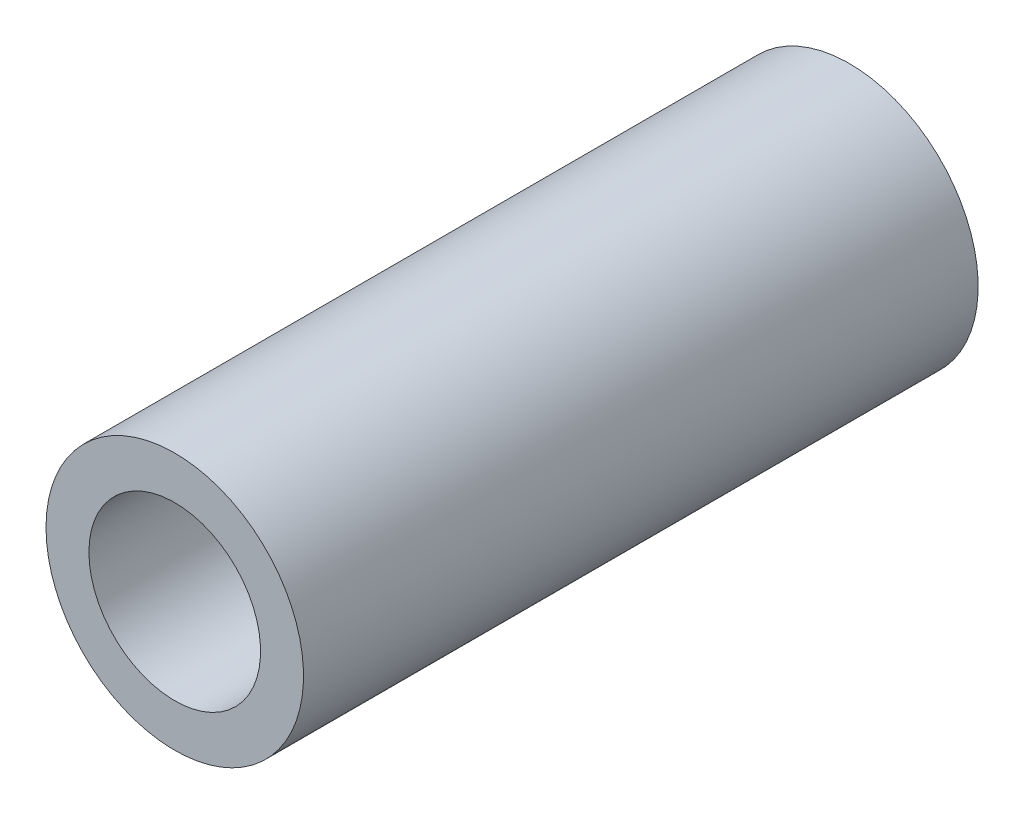
from build123d import *

# Parameters (mm, degrees)
SKETCH1_R           = 2.38125
SKETCH1_R_2         = 1.5875
BOSS_EXTRUDE1_DEPTH = 12.47775


with BuildPart() as part:
    # Sketch1 → Boss-Extrude1 (new body)
    with BuildSketch(Plane.XY):
        with Locations(Location((0, 0, 0), (0, 0, 180))):
            Circle(SKETCH1_R)
        with Locations(Location((0, 0, 0), (0, 0, 180))):
            Circle(SKETCH1_R_2, mode=Mode.SUBTRACT)
    extrude(amount=BOSS_EXTRUDE1_DEPTH)


solid = part.part
